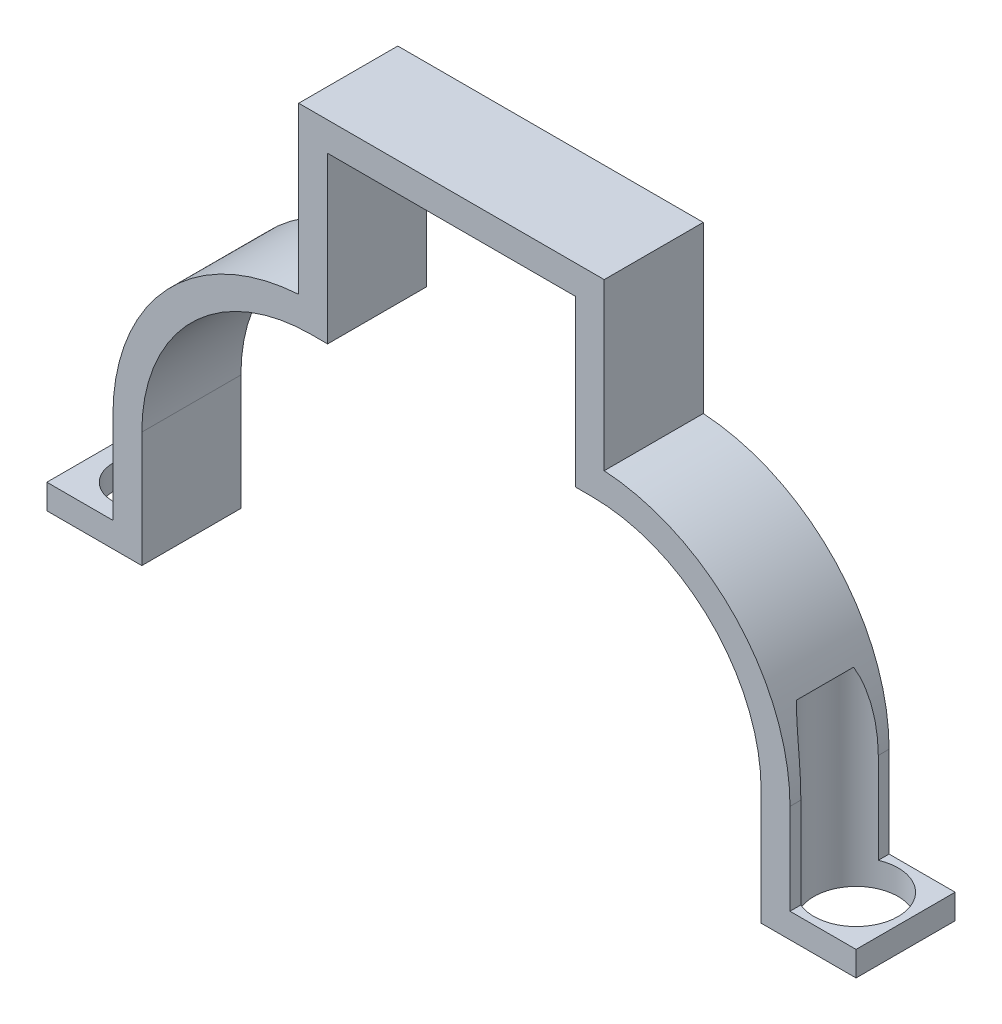
from build123d import *

# Parameters (mm, degrees)
EXTRUDE_1_DEPTH          = 6
CUT_EXTRUDE_1_DEPTH      = 10
CUT_EXTRUDE_1_DEPTH_BACK = 10
SKETCH_2_R               = 2
CUT_EXTRUDE_START        = -10
CUT_EXTRUDE_2_DEPTH      = 10


with BuildPart() as part:
    # 스케치1 → 보스-돌출1 (new body)
    with BuildSketch(Plane.XY):
        with BuildLine():
            Line((31.75, 18.5), (33, 18.5))
            ThreePointArc((33, 18.5), (40.071067812, 15.571067812), (43, 8.5))
            Line((43, 8.5), (43, 1.5))
            Line((43, 1.5), (49, 1.5))
            Line((49, 1.5), (49, 3))
            Line((49, 3), (45, 3))
            Line((45, 3), (45, 8.5))
            ThreePointArc((45, 8.5), (41.746427842, 16.715838363), (33.75, 20.476539567))
            Line((33.75, 20.476539567), (33.75, 30.5))
            Line((33.75, 30.5), (15.25, 30.5))
            Line((15.25, 30.5), (15.25, 20.476539567))
            ThreePointArc((15.25, 20.476539567), (7.253572158, 16.715838363), (4, 8.5))
            Line((4, 8.5), (4, 3))
            Line((4, 3), (0, 3))
            Line((0, 3), (0, 1.5))
            Line((0, 1.5), (6, 1.5))
            Line((6, 1.5), (6, 8.5))
            ThreePointArc((6, 8.5), (8.928932188, 15.571067812), (16, 18.5))
            Line((16, 18.5), (17.25, 18.5))
            Line((17.25, 18.5), (17.25, 28.5))
            Line((17.25, 28.5), (31.75, 28.5))
            Line((31.75, 28.5), (31.75, 18.5))
        make_face()
    extrude(amount=EXTRUDE_1_DEPTH)

    # 스케치2 → 컷-돌출1 (cut, two sides: drawn at the far end of the back side and taken through both)
    with BuildSketch(Plane(origin=(0, 3, 0), x_dir=(1, 0, 0), z_dir=(0, 1, 0)).offset(-CUT_EXTRUDE_1_DEPTH_BACK)):
        with BuildLine():
            ThreePointArc((45, -5.345740821), (47.405791592, -5.127498531), (48.55, -3))
            ThreePointArc((48.55, -3), (47.405791592, -0.872501469), (45, -0.654259179))
            Line((45, -0.654259179), (45, -5.345740821))
        make_face()
        with BuildLine():
            Line((45, -5.345740821), (45, -0.654259179))
            ThreePointArc((45, -0.654259179), (43.45, -3), (45, -5.345740821))
        make_face()
        with Locations(Location((3, -3, 0), (0, 0, 60))):
            Circle(SKETCH_2_R)
    extrude(amount=CUT_EXTRUDE_1_DEPTH + CUT_EXTRUDE_1_DEPTH_BACK, mode=Mode.SUBTRACT)

    # 스케치3 → 컷-돌출2 (cut)
    with BuildSketch(Plane.XY.offset(6).offset(CUT_EXTRUDE_START)):
        with BuildLine():
            Line((5.75, 1.5), (5.75, 8.5))
            ThreePointArc((5.75, 8.5), (8.752155493, 15.747844507), (16, 18.75))
            Line((16, 18.75), (17, 18.75))
            Line((17, 18.75), (17, 28.75))
            Line((17, 28.75), (32, 28.75))
            Line((32, 28.75), (32, 18.75))
            Line((32, 18.75), (33, 18.75))
            ThreePointArc((33, 18.75), (40.247844507, 15.747844507), (43.25, 8.5))
            Line((43.25, 8.5), (43.25, 1.5))
            Line((43.25, 1.5), (43, 1.5))
            Line((43, 1.5), (43, 8.5))
            ThreePointArc((43, 8.5), (40.071067812, 15.571067812), (33, 18.5))
            Line((33, 18.5), (31.75, 18.5))
            Line((31.75, 18.5), (31.75, 28.5))
            Line((31.75, 28.5), (17.25, 28.5))
            Line((17.25, 28.5), (17.25, 18.5))
            Line((17.25, 18.5), (16, 18.5))
            ThreePointArc((16, 18.5), (8.928932188, 15.571067812), (6, 8.5))
            Line((6, 8.5), (6, 1.5))
            Line((6, 1.5), (5.75, 1.5))
        make_face()
    extrude(amount=CUT_EXTRUDE_2_DEPTH, mode=Mode.SUBTRACT)


solid = part.part
